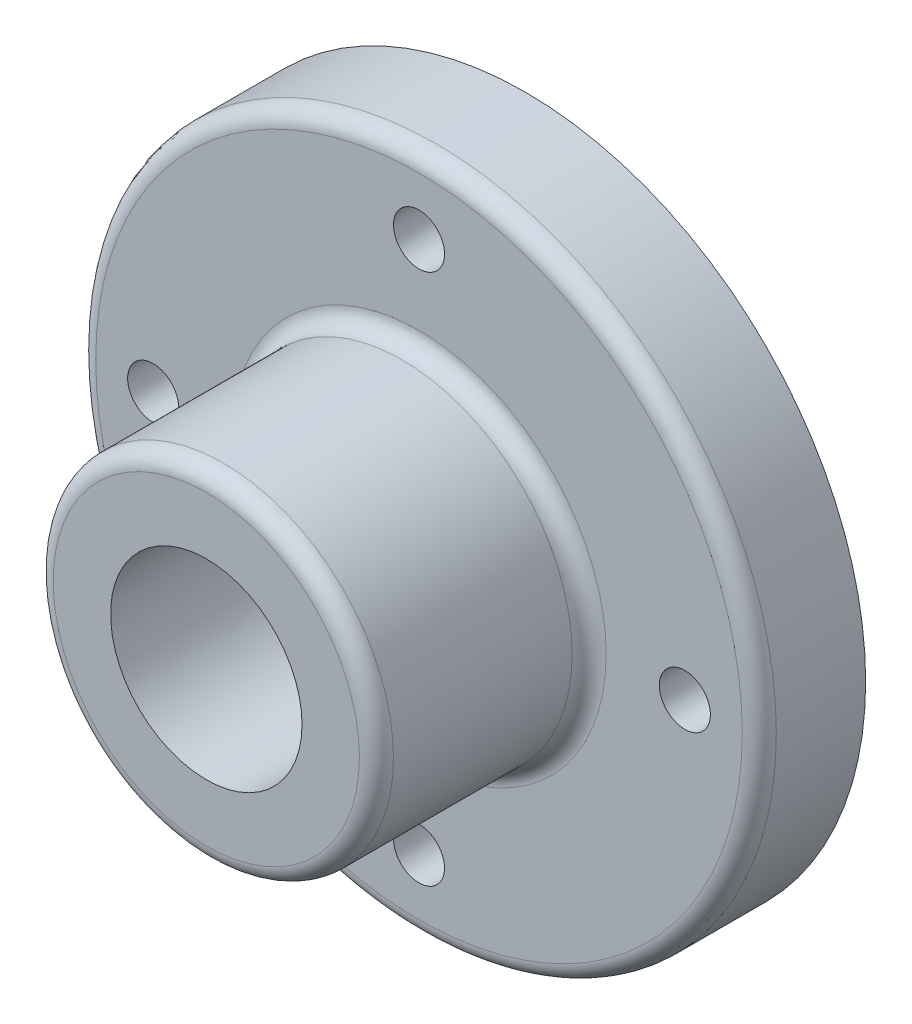
from build123d import *

# Parameters (mm, degrees)
ESQUISSE1_R             = 80
BOSS_EXTRU_1_DEPTH      = 25
ESQUISSE2_R             = 40
BOSS_EXTRU_2_DEPTH      = 50
ESQUISSE3_R             = 6
ENL_V_MAT_EXTRU_1_DEPTH = 124.693168769
ESQUISSE4_R             = 22.5
ENL_V_MAT_EXTRU_2_DEPTH = 136.738719605
CONG_1_R                = 4


with BuildPart() as part:
    # Esquisse1 → Boss.-Extru.1 (new body)
    with BuildSketch(Plane.XY):
        Circle(ESQUISSE1_R)
    extrude(amount=BOSS_EXTRU_1_DEPTH)

    # Esquisse2 → Boss.-Extru.2 (add)
    with BuildSketch(Plane.XY.offset(25)):
        Circle(ESQUISSE2_R)
    extrude(amount=BOSS_EXTRU_2_DEPTH)

    # Esquisse3 → Enlèv. mat.-Extru.1 (cut, through all)
    with BuildSketch(Plane.XY.offset(25)):
        with Locations((0, 62.5)):
            Circle(ESQUISSE3_R)
        with Locations((62.5, 0)):
            Circle(ESQUISSE3_R)
        with Locations((0, -62.5)):
            Circle(ESQUISSE3_R)
        with Locations((-62.5, 0)):
            Circle(ESQUISSE3_R)
    extrude(amount=-ENL_V_MAT_EXTRU_1_DEPTH, mode=Mode.SUBTRACT)

    # Esquisse4 → Enlèv. mat.-Extru.2 (cut, through all)
    with BuildSketch(Plane.XY.offset(75)):
        Circle(ESQUISSE4_R)
    extrude(amount=-ENL_V_MAT_EXTRU_2_DEPTH, mode=Mode.SUBTRACT)

    # Congé1
    cong_1_edges = [part.edges().sort_by_distance(p)[0] for p in [
        (-80, 0, 25),
        (-40, 0, 25),
        (-40, 0, 75),
    ]]
    fillet(cong_1_edges, radius=CONG_1_R)


solid = part.part
